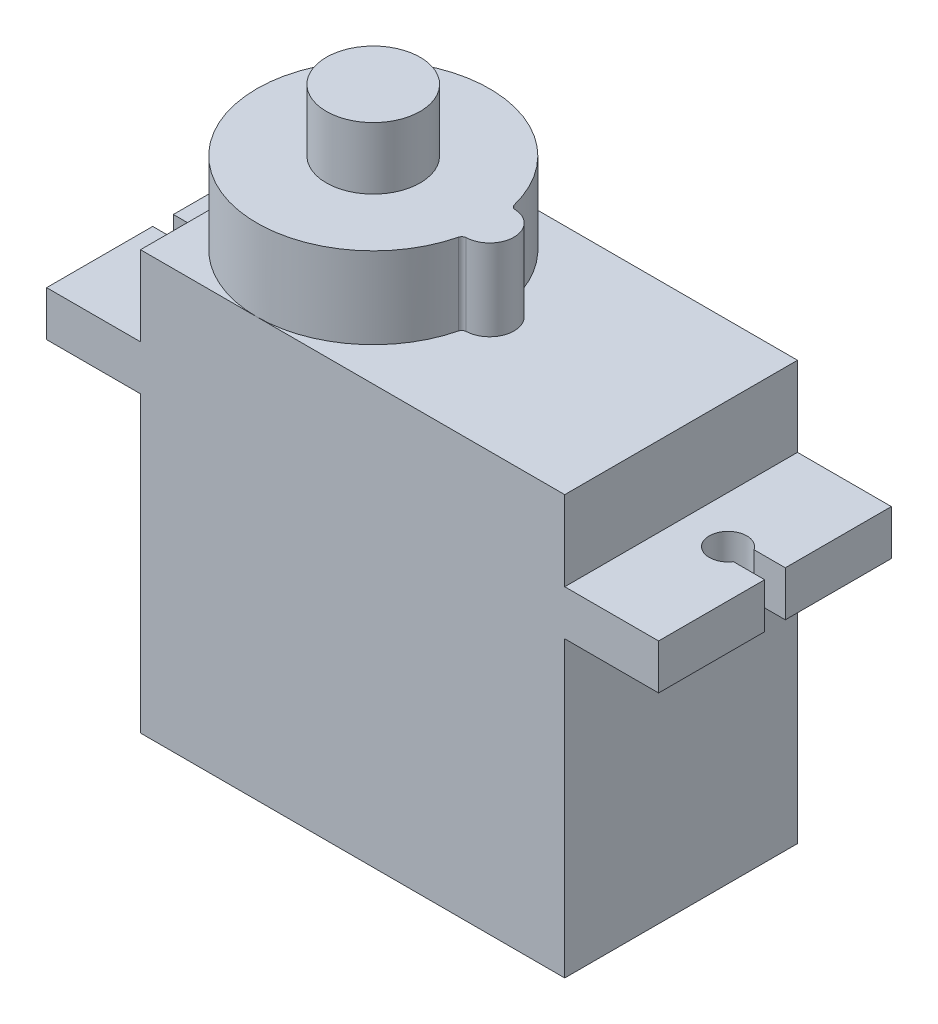
from build123d import *

# Parameters (mm, degrees)
SKETCH1_W             = 22.6
SKETCH1_H             = 12.4
BOSS_EXTRUDE1_DEPTH   = 22.3
SKETCH2_W             = 5
SKETCH2_H             = 2.4
BOSS_EXTRUDE2_DEPTH   = 12.4
CUT_EXTRUDE_S_DEPTH   = 26.098456128
BOSS_EXTRUDE3_DEPTH   = 4.33
SKETCH5_R             = 2.5
BOSS_EXTRUDE4_DEPTH   = 3.3
SKETCH6_R             = 0.6
BOSS_EXTRUDE6_DEPTH   = 2.3
BOSS_EXTRUDE6_2_DEPTH = 2.3
BOSS_EXTRUDE6_3_DEPTH = 2.3


with BuildPart() as part:
    # Sketch1 → Boss-Extrude1 (new body)
    with BuildSketch(Plane(origin=(0, 0, 0), x_dir=(1, 0, 0), z_dir=(0, 1, 0))):
        Rectangle(SKETCH1_W, SKETCH1_H)
    extrude(amount=BOSS_EXTRUDE1_DEPTH)

    # Sketch2 → Boss-Extrude2 (add)
    with BuildSketch(Plane.XY.offset(6.2)):
        with Locations((13.8, 16.85)):
            Rectangle(SKETCH2_W, SKETCH2_H)
        with Locations((-13.8, 16.85)):
            Rectangle(SKETCH2_W, SKETCH2_H)
    extrude(amount=-BOSS_EXTRUDE2_DEPTH)

    # Sketch3 → Cut-Extrude s (cut, through all)
    with BuildSketch(Plane(origin=(0, 18.05, 0), x_dir=(1, 0, 0), z_dir=(0, 1, 0))):
        with BuildLine():
            Line((16.3, 0.55), (14.635164654, 0.55))
            ThreePointArc((14.635164654, 0.55), (12.8, 0), (14.635164654, -0.55))
            Line((14.635164654, -0.55), (16.3, -0.55))
            Line((16.3, -0.55), (16.3, 0.55))
        make_face()
    cut_extrude_s = extrude(amount=-CUT_EXTRUDE_S_DEPTH, mode=Mode.SUBTRACT)

    # Mirror1: Cut-Extrude s across plane
    add(cut_extrude_s.mirror(Plane(origin=(0, 0, 0), x_dir=(0, 0, 1), z_dir=(1, 0, 0))), mode=Mode.SUBTRACT)

    # Sketch4 → Boss-Extrude3 (add)
    with BuildSketch(Plane(origin=(0, 22.3, 0), x_dir=(1, 0, 0), z_dir=(0, 1, 0))):
        with BuildLine():
            ThreePointArc((0.918604651, 1.488757218), (-11.3, 0), (0.918604651, -1.488757218))
            ThreePointArc((0.918604651, -1.488757218), (1.003329596, -1.355013632), (1.151404787, -1.298983275))
            ThreePointArc((1.151404787, -1.298983275), (2.4, 0), (1.151404787, 1.298983275))
            ThreePointArc((1.151404787, 1.298983275), (1.003329596, 1.355013632), (0.918604651, 1.488757218))
        make_face()
    extrude(amount=BOSS_EXTRUDE3_DEPTH)

    # Sketch5 → Boss-Extrude4 (add)
    with BuildSketch(Plane(origin=(0, 26.63, 0), x_dir=(1, 0, 0), z_dir=(0, 1, 0))):
        with Locations(Location((-5.1, 0, 0), (0, 0, 270))):
            Circle(SKETCH5_R)
    extrude(amount=BOSS_EXTRUDE4_DEPTH)


with BuildPart() as body_2:
    # Sketch6 → Boss-Extrude6 (new body)
    with BuildSketch(Plane.ZY.offset(11.3)):
        with Locations((1.2, 4.5)):
            Circle(SKETCH6_R)
    extrude(amount=BOSS_EXTRUDE6_DEPTH)


with BuildPart() as body_3:
    # Sketch6 → Boss-Extrude6 2 (new body)
    with BuildSketch(Plane.ZY.offset(11.3)):
        with Locations((0, 4.5)):
            Circle(SKETCH6_R)
    extrude(amount=BOSS_EXTRUDE6_2_DEPTH)


with BuildPart() as body_4:
    # Sketch6 → Boss-Extrude6 3 (new body)
    with BuildSketch(Plane.ZY.offset(11.3)):
        with Locations((-1.2, 4.5)):
            Circle(SKETCH6_R)
    extrude(amount=BOSS_EXTRUDE6_3_DEPTH)


solid = Compound([part.part, body_2.part, body_3.part, body_4.part])
